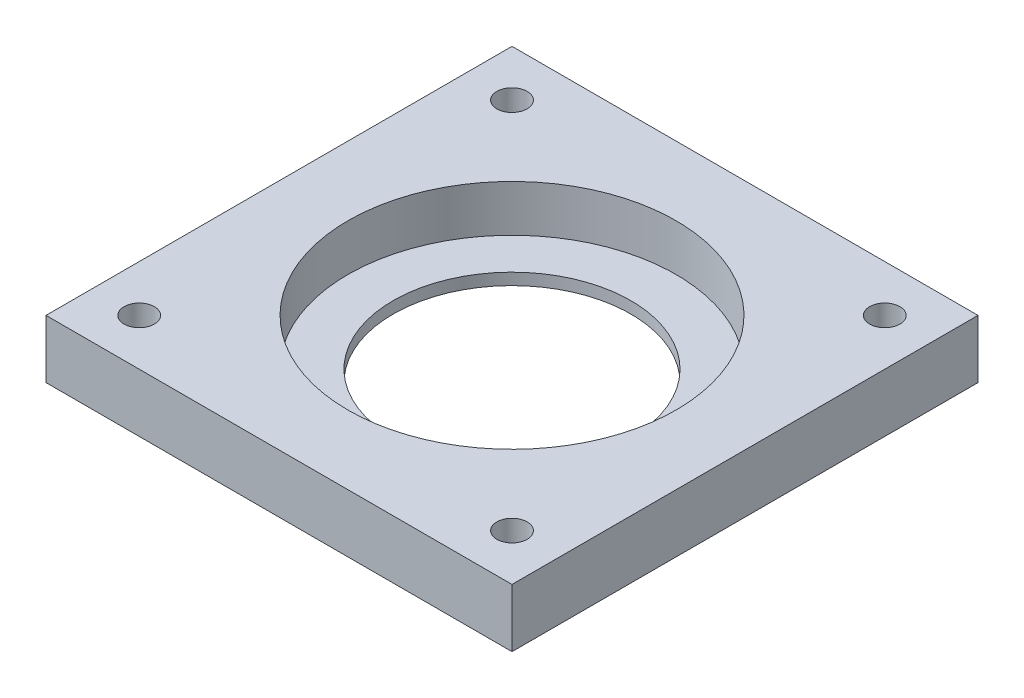
from build123d import *

# Parameters (mm, degrees)
CROQUIS1_W              = 100
CROQUIS1_H              = 100
SALIENTE_EXTRUIR1_DEPTH = 12.5
CROQUIS2_R              = 35.2
CORTAR_EXTRUIR1_DEPTH   = 10
CROQUIS3_R              = 25.5
CORTAR_EXTRUIR2_DEPTH   = 72.414284285
CORTAR_EXTRUIR3_DEPTH   = 72.807033082
MATRIZC1_COUNT          = 4


with BuildPart() as part:
    # Croquis1 → Saliente-Extruir1 (new body)
    with BuildSketch(Plane(origin=(0, 0, 0), x_dir=(1, 0, 0), z_dir=(0, 1, 0))):
        Rectangle(CROQUIS1_W, CROQUIS1_H)
    extrude(amount=SALIENTE_EXTRUIR1_DEPTH)

    # Croquis2 → Cortar-Extruir1 (cut)
    with BuildSketch(Plane(origin=(0, 12.5, 0), x_dir=(1, 0, 0), z_dir=(0, 1, 0))):
        with Locations(Location((0, 0, 0), (0, 0, 270))):
            Circle(CROQUIS2_R)
    extrude(amount=-CORTAR_EXTRUIR1_DEPTH, mode=Mode.SUBTRACT)

    # Croquis3 → Cortar-Extruir2 (cut, through all)
    with BuildSketch(Plane(origin=(0, 2.5, 0), x_dir=(1, 0, 0), z_dir=(0, 1, 0))):
        with Locations(Location((0, 0, 0), (0, 0, 270))):
            Circle(CROQUIS3_R)
    extrude(amount=-CORTAR_EXTRUIR2_DEPTH, mode=Mode.SUBTRACT)

    # Croquis4 → Cortar-Extruir3 (cut, through all)
    with BuildSketch(Plane(origin=(0, 12.5, 0), x_dir=(1, 0, 0), z_dir=(0, 1, 0))):
        with BuildLine():
            ThreePointArc((36.75, 40), (37.701902961, 37.701902961), (40, 36.75))
            Line((40, 36.75), (40, 40))
            Line((40, 40), (36.75, 40))
        make_face()
        with BuildLine():
            Line((40, 40), (40, 36.75))
            ThreePointArc((40, 36.75), (42.298097039, 37.701902961), (43.25, 40))
            ThreePointArc((43.25, 40), (40, 43.25), (36.75, 40))
            Line((36.75, 40), (40, 40))
        make_face()
    cortar_extruir3 = extrude(amount=-CORTAR_EXTRUIR3_DEPTH, mode=Mode.SUBTRACT)

    # MatrizC1: Cortar-Extruir3 ×4 about axis
    matrizc1_axis = Axis((0, 0, 0), (0, 1, 0))
    for i in range(1, MATRIZC1_COUNT):
        add(cortar_extruir3.rotate(matrizc1_axis, i * 360 / MATRIZC1_COUNT), mode=Mode.SUBTRACT)


solid = part.part
